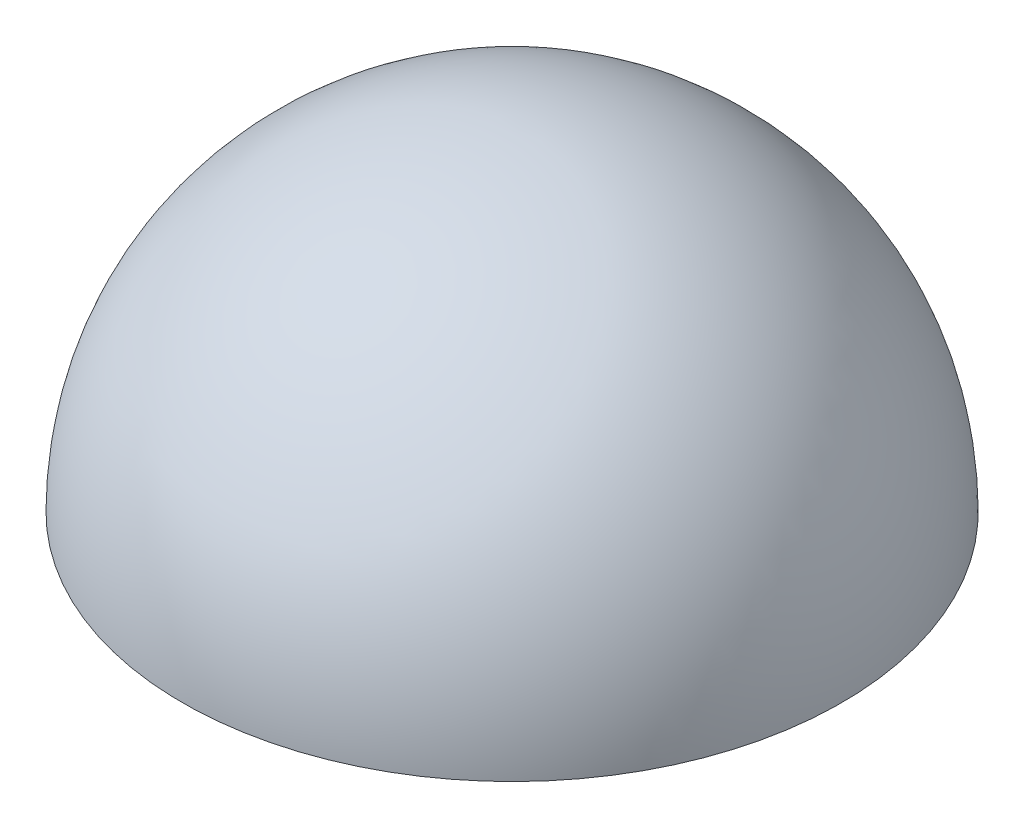
from build123d import *

# Parameters (mm, degrees)
REVOLVE_1_ANGLE = 180


with BuildPart() as part:
    # 草图1 → 旋转1 (revolve)
    with BuildSketch(Plane(origin=(0, 0, 0), x_dir=(1, 0, 0), z_dir=(0, 1, 0))):
        with BuildLine():
            Line((-10, 0), (10, 0))
            ThreePointArc((10, 0), (0, 10), (-10, 0))
        make_face()
    revolve(axis=Axis((-10, 0, 0), (1, 0, 0)), revolution_arc=REVOLVE_1_ANGLE)


solid = part.part
